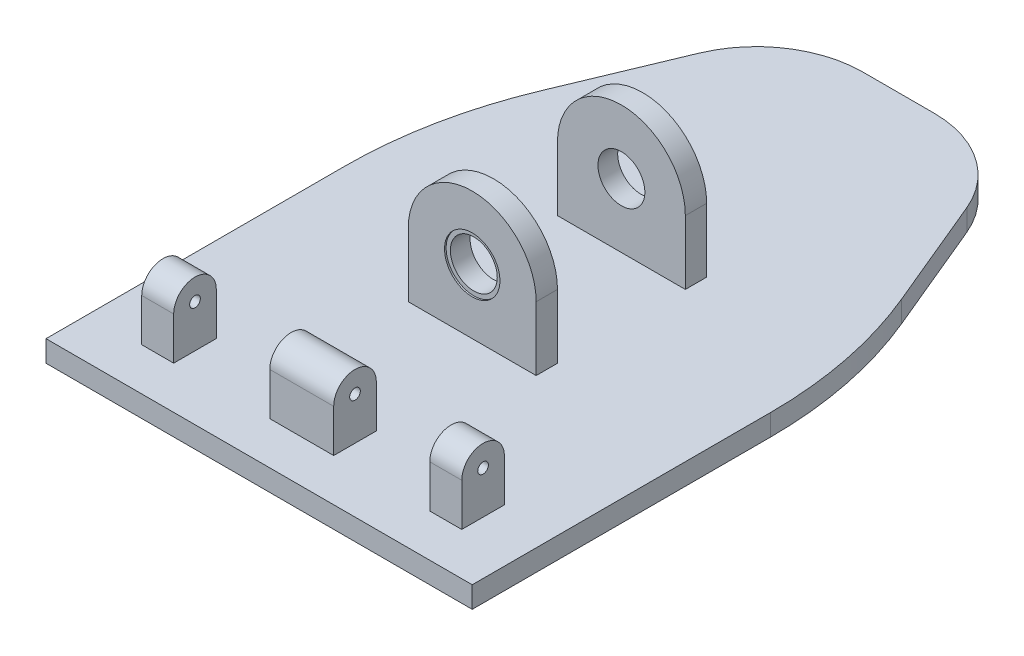
from build123d import *

# Parameters (mm, degrees)
EXTRUDE_1_DEPTH      = 10
EXTRUDE_START        = -100
EXTRUDE_3_DEPTH      = 80
SKETCH_5_W           = 80
SKETCH_5_H           = 60
CUT_EXTRUDE_2_DEPTH  = 110
FILLET_1_R           = 50
FILLET_2_R           = 200
SKETCH_16_R          = 13
CUT_EXTRUDE_10_DEPTH = 0.75
CUT_EXTRUDE_START    = -0.75
SKETCH_17_R          = 13
CUT_EXTRUDE_11_DEPTH = 0.75
SKETCH_18_R          = 2.5
EXTRUDE_6_DEPTH      = 200
SKETCH_20_W          = 45.086358536
SKETCH_20_H          = 37.636191029
SKETCH_20_W_2        = 32.7550468
SKETCH_20_H_2        = 44.701005045
CUT_EXTRUDE_12_DEPTH = 322.869538789


with BuildPart() as part:
    # 草图1 → 凸台-拉伸1 (new body)
    with BuildSketch(Plane(origin=(0, 0, 0), x_dir=(1, 0, 0), z_dir=(0, 1, 0))):
        Polygon((-100, 0), (100, 0), (100, 180), (50, 300), (-50, 300), (-100, 180), align=None)
    extrude(amount=EXTRUDE_1_DEPTH)

    # 草图4 → 凸台-拉伸3 (add)
    with BuildSketch(Plane.XY.offset(EXTRUDE_START)):
        with BuildLine():
            Line((0, 29), (0, 10))
            Line((0, 10), (30, 10))
            Line((30, 10), (30, 40))
            ThreePointArc((30, 40), (21.213203436, 61.213203436), (0, 70))
            Line((0, 70), (0, 51))
            ThreePointArc((0, 51), (7.778174593, 47.778174593), (11, 40))
            ThreePointArc((11, 40), (7.778174593, 32.221825407), (0, 29))
        make_face()
        with BuildLine():
            Line((-30, 10), (0, 10))
            Line((0, 10), (0, 29))
            ThreePointArc((0, 29), (-11, 40), (0, 51))
            Line((0, 51), (0, 70))
            ThreePointArc((0, 70), (-21.213203436, 61.213203436), (-30, 40))
            Line((-30, 40), (-30, 10))
        make_face()
    extrude(amount=-EXTRUDE_3_DEPTH)

    # 草图5 → 切除-拉伸2 (cut)
    with BuildSketch(Plane(origin=(0, 10, 0), x_dir=(1, 0, 0), z_dir=(0, 1, 0))):
        with Locations((0, 140)):
            Rectangle(SKETCH_5_W, SKETCH_5_H)
    extrude(amount=CUT_EXTRUDE_2_DEPTH, mode=Mode.SUBTRACT)

    # 圆角1
    fillet_1_edges = [part.edges().sort_by_distance(p)[0] for p in [
        (-50, 5, -300),
        (50, 5, -300),
    ]]
    fillet(fillet_1_edges, radius=FILLET_1_R)

    # 圆角2
    fillet_2_edges = [part.edges().sort_by_distance(p)[0] for p in [
        (-100, 5, -180),
        (100, 5, -180),
    ]]
    fillet(fillet_2_edges, radius=FILLET_2_R)

    # 草图16 → 切除-拉伸10 (cut)
    with BuildSketch(Plane.XY.offset(-100)):
        with Locations((0, 40)):
            Circle(SKETCH_16_R)
    extrude(amount=-CUT_EXTRUDE_10_DEPTH, mode=Mode.SUBTRACT)

    # 草图17 → 切除-拉伸11 (cut)
    with BuildSketch(Plane(origin=(0, 0, -180), x_dir=(-1, 0, 0), z_dir=(0, 0, -1)).offset(CUT_EXTRUDE_START)):
        with Locations(Location((0, 40, 0), (0, 0, 180))):
            Circle(SKETCH_17_R)
    extrude(amount=CUT_EXTRUDE_11_DEPTH, mode=Mode.SUBTRACT)

    # 草图18 → 凸台-拉伸6 (add)
    with BuildSketch(Plane.ZY.offset(100)):
        with BuildLine():
            Line((-40, 10), (-40, 30))
            ThreePointArc((-40, 30), (-30, 40), (-20, 30))
            Line((-20, 30), (-20, 10))
            Line((-20, 10), (-40, 10))
        make_face()
        with Locations((-30, 30)):
            Circle(SKETCH_18_R, mode=Mode.SUBTRACT)
    extrude(amount=-EXTRUDE_6_DEPTH)

    # 草图20 → 切除-拉伸12 (cut, through all)
    with BuildSketch(Plane(origin=(0, 10, 0), x_dir=(1, 0, 0), z_dir=(0, 1, 0))):
        with Locations((-37.543179268, 30.422188826)):
            Rectangle(SKETCH_20_W, SKETCH_20_H)
        with Locations((91.463881936, 29.458805096)):
            Rectangle(SKETCH_20_W_2, SKETCH_20_H_2)
        with Locations((37.543179268, 30.422188826)):
            Rectangle(SKETCH_20_W, SKETCH_20_H)
        with Locations((-91.463881936, 29.458805096)):
            Rectangle(SKETCH_20_W_2, SKETCH_20_H_2)
    extrude(amount=CUT_EXTRUDE_12_DEPTH, mode=Mode.SUBTRACT)


solid = part.part
